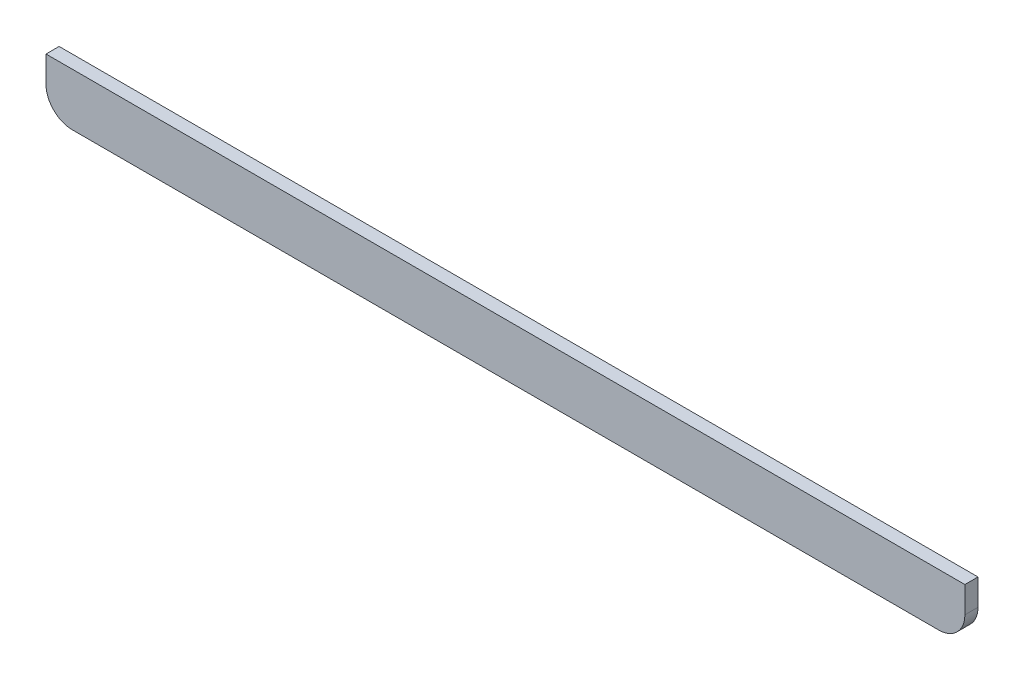
from build123d import *

# Parameters (mm, degrees)
BOSS_EXTRU_1_DEPTH = 5


with BuildPart() as part:
    # Esquisse1 → Boss.-Extru.1 (new body)
    with BuildSketch(Plane.XY):
        with BuildLine():
            Line((10, 0), (340, 0))
            ThreePointArc((340, 0), (347.071067812, 2.928932188), (350, 10))
            Line((350, 10), (350, 20))
            Line((350, 20), (0, 20))
            Line((0, 20), (0, 10))
            ThreePointArc((0, 10), (2.928932188, 2.928932188), (10, 0))
        make_face()
    extrude(amount=BOSS_EXTRU_1_DEPTH)


solid = part.part
